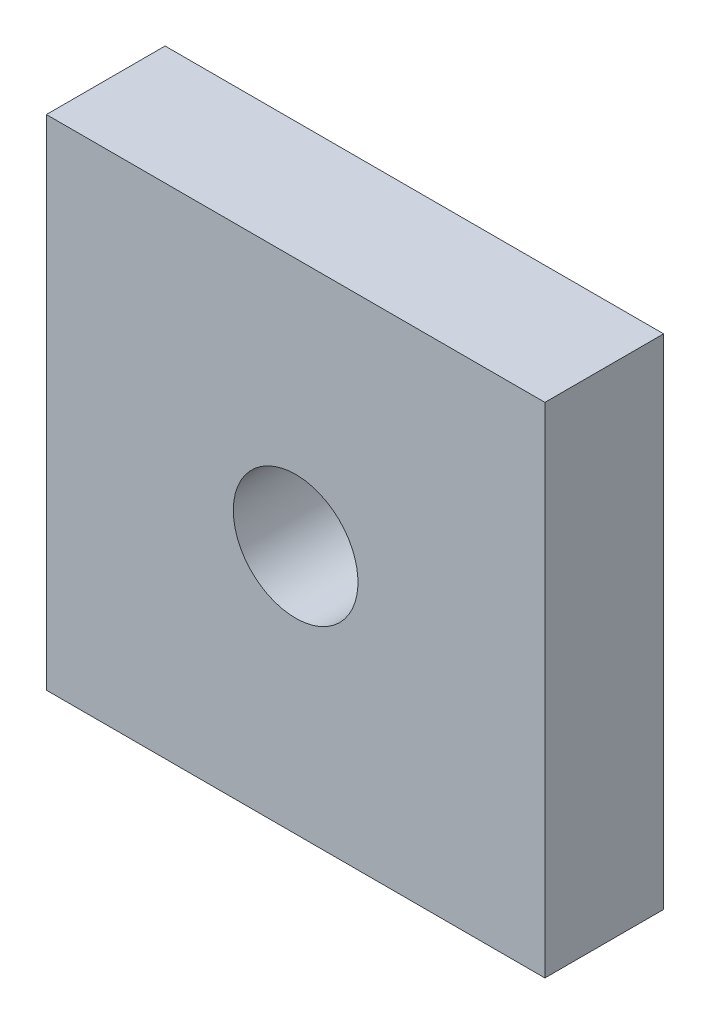
from build123d import *

# Parameters (mm, degrees)
SKETCH1_W           = 20
SKETCH1_H           = 20
SKETCH1_R           = 2.5
BOSS_EXTRUDE1_DEPTH = 4.7625


with BuildPart() as part:
    # Sketch1 → Boss-Extrude1 (new body)
    with BuildSketch(Plane.XY):
        Rectangle(SKETCH1_W, SKETCH1_H)
        with Locations(Location((0, 0, 0), (0, 0, 180))):
            Circle(SKETCH1_R, mode=Mode.SUBTRACT)
    extrude(amount=BOSS_EXTRUDE1_DEPTH)


solid = part.part
